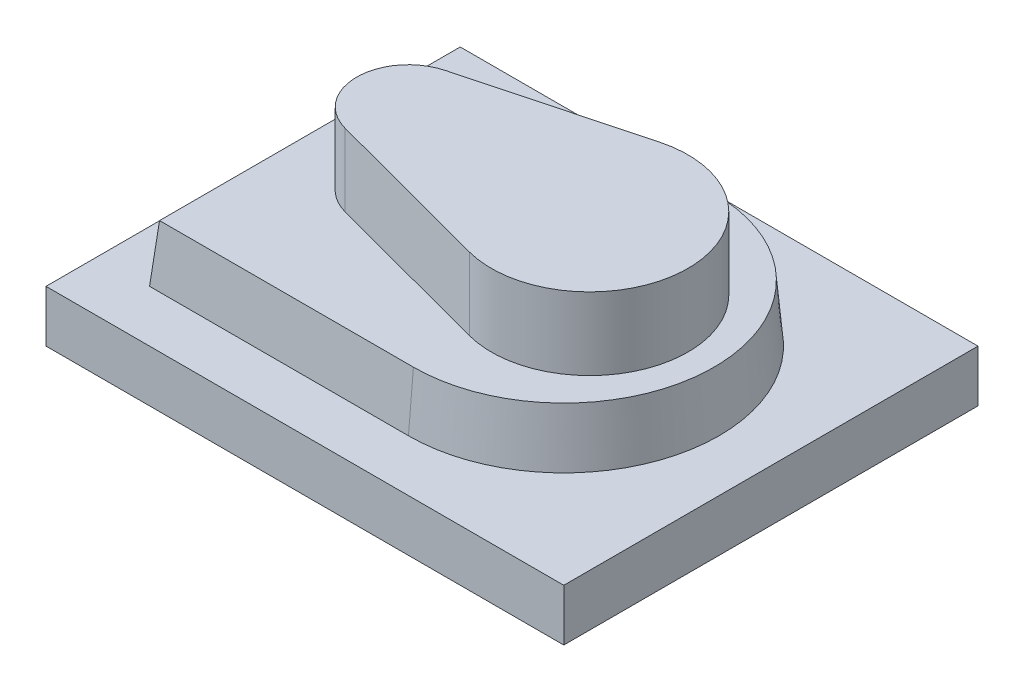
from build123d import *

# Parameters (mm, degrees)
SKETCH_1_W      = 100
SKETCH_1_H      = 80
EXTRUDE_1_DEPTH = 10
EXTRUDE_2_DEPTH = 11
EXTRUDE_2_TAPER = 5
EXTRUDE_3_DEPTH = 14


with BuildPart() as part:
    # 스케치1 → 보스-돌출1 (new body)
    with BuildSketch(Plane(origin=(0, 0, 0), x_dir=(1, 0, 0), z_dir=(0, 1, 0))):
        Rectangle(SKETCH_1_W, SKETCH_1_H)
    extrude(amount=EXTRUDE_1_DEPTH)

    # 스케치2 → 보스-돌출2 (add)
    with BuildSketch(Plane(origin=(0, 10, 0), x_dir=(1, 0, 0), z_dir=(0, 1, 0))):
        with BuildLine():
            Line((10, 30), (-40, 30))
            Line((-40, 30), (-40, -30))
            Line((-40, -30), (10, -30))
            ThreePointArc((10, -30), (40, 0), (10, 30))
        make_face()
    extrude(amount=EXTRUDE_2_DEPTH, taper=EXTRUDE_2_TAPER)

    # 스케치3 → 보스-돌출3 (add)
    with BuildSketch(Plane(origin=(0, 21, 0), x_dir=(1, 0, 0), z_dir=(0, 1, 0))):
        with BuildLine():
            Line((-22.571428571, 9.663734014), (10.114285714, 18.361094627))
            ThreePointArc((10.114285714, 18.361094627), (34, 0), (10.114285714, -18.361094627))
            Line((10.114285714, -18.361094627), (-22.571428571, -9.663734014))
            ThreePointArc((-22.571428571, -9.663734014), (-30, 0), (-22.571428571, 9.663734014))
        make_face()
    extrude(amount=EXTRUDE_3_DEPTH)


solid = part.part
